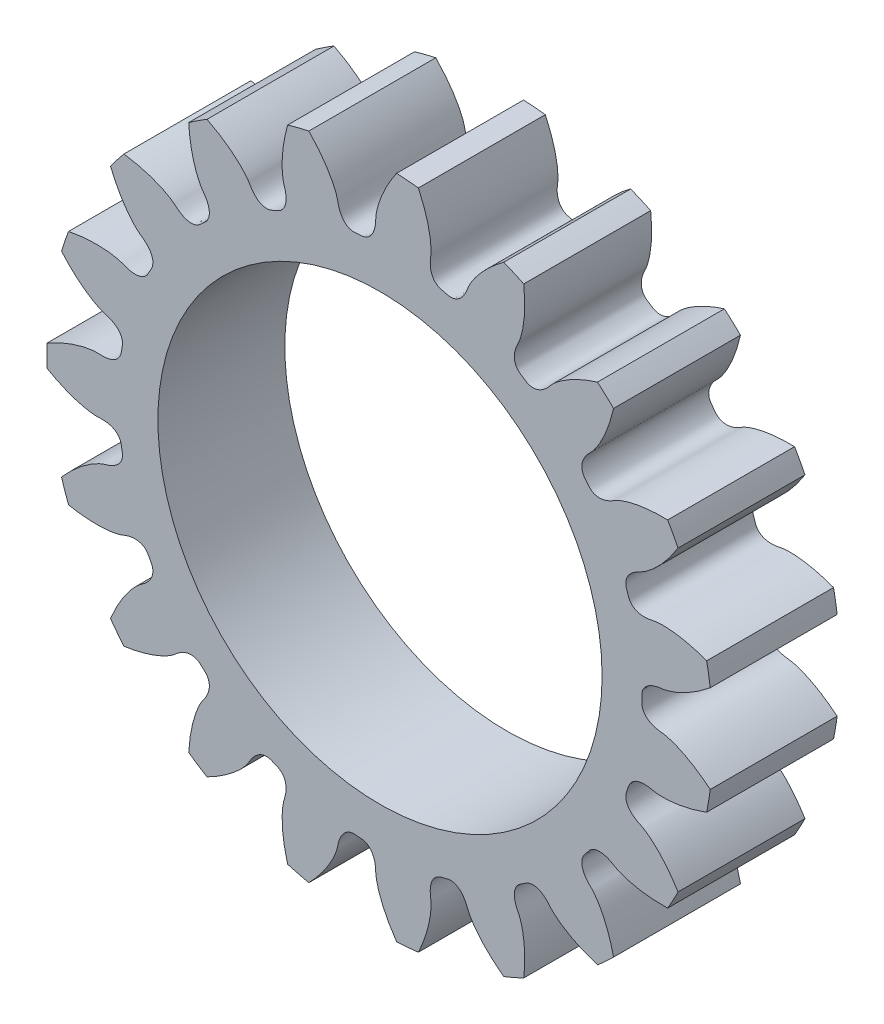
from build123d import *

# Parameters (mm, degrees)
SKETCHREVOLVESPURPINION_W       = 4
SKETCHREVOLVESPURPINION_H       = 10.499999842
TOOTHEXTRUDECUTSPURPINION_DEPTH = 2
PATTERNSPURPINION_COUNT         = 19
BOREREVOLVESKETCH_W             = 4
BOREREVOLVESKETCH_H             = 7


with BuildPart() as part:
    # SketchRevolveSpurPinion → SpurPinion (revolve)
    with BuildSketch(Plane(origin=(0, 0, 0), x_dir=(0, 0, -1), z_dir=(1, 0, 0)), mode=Mode.PRIVATE) as spurpinion_sk:
        with Locations((0, 5.249999921)):
            Rectangle(SKETCHREVOLVESPURPINION_W, SKETCHREVOLVESPURPINION_H)
    revolve(spurpinion_sk.sketch.rotate(Axis((0, 0, 0), (0, 0, -1)), 90), axis=Axis((0, 0, 0), (0, 0, -1)))

    # SketchToothSpurPinion → ToothExtrudeCutSpurPinion (cut, symmetric)
    with BuildSketch(Plane.XY):
        with BuildLine():
            ThreePointArc((10.453262131, 1.425414845), (10.549999842, 0), (10.453262131, -1.425414845))
            add(Edge.make_bspline(
                [(10.453262131, -1.425414845), (10.367326035, -1.353394637), (10.238669333, -1.251930275), (10.06564964, -1.128594361), (9.944090061, -1.047585267), (9.827560604, -0.975115164), (9.716470975, -0.910782508), (9.611210442, -0.85416847), (9.512147156, -0.804838071), (9.419627534, -0.762341023), (9.333975658, -0.726212752), (9.255492748, -0.69597514), (9.18445657, -0.671138213), (9.121121218, -0.651198945), (9.065715879, -0.635649067), (9.018446854, -0.623955761), (8.979490203, -0.615621666), (8.949010683, -0.610024033), (8.878787982, -0.599777793), (8.800543269, -0.593138323), (8.714424347, -0.574156579), (8.664508232, -0.560968978), (8.616505827, -0.545516093), (8.57026023, -0.527710712), (8.525615161, -0.507231311), (8.482414686, -0.483648426), (8.440551516, -0.456336336), (8.400050156, -0.42444098), (8.361222153, -0.386864097), (8.32489058, -0.342351194), (8.292714702, -0.289772335), (8.267151791, -0.228753234), (8.253099937, -0.165661214), (8.247308524, -0.088583022), (8.251745547, 0), (8.247308524, 0.088583022), (8.253099937, 0.165661214), (8.267151791, 0.228753234), (8.292714702, 0.289772335), (8.32489058, 0.342351194), (8.361222153, 0.386864097), (8.400050156, 0.42444098), (8.440551516, 0.456336336), (8.482414686, 0.483648426), (8.525615161, 0.507231311), (8.57026023, 0.527710712), (8.616505827, 0.545516093), (8.664508232, 0.560968978), (8.714424347, 0.574156579), (8.800543269, 0.593138323), (8.878787982, 0.599777793), (8.949010683, 0.610024033), (8.979490203, 0.615621666), (9.018446854, 0.623955761), (9.065715879, 0.635649067), (9.121121218, 0.651198945), (9.18445657, 0.671138213), (9.255492748, 0.69597514), (9.333975658, 0.726212752), (9.419627534, 0.762341023), (9.512147156, 0.804838071), (9.611210442, 0.85416847), (9.716470975, 0.910782508), (9.827560604, 0.975115164), (9.944090061, 1.047585267), (10.06564964, 1.128594361), (10.238669333, 1.251930275), (10.367326035, 1.353394637), (10.453262131, 1.425414845)],
                knots=[0, 0, 0, 0, 0.060396063, 0.088210039, 0.114434645, 0.139069881, 0.162115748, 0.183572244, 0.20343937, 0.221717126, 0.238405512, 0.253504528, 0.267014174, 0.278934451, 0.289265357, 0.298006893, 0.305159059, 0.310721856, 0.314695284, 0.343384638, 0.352907201, 0.362159078, 0.371188538, 0.380055981, 0.388837197, 0.397627176, 0.406543928, 0.415730909, 0.425354803, 0.435592533, 0.44659872, 0.458447759, 0.471062798, 0.481230687, 0.5, 0.518769313, 0.528937202, 0.541552241, 0.55340128, 0.564407467, 0.574645197, 0.584269091, 0.593456072, 0.602372824, 0.611162803, 0.619944019, 0.628811462, 0.637840922, 0.647092799, 0.656615362, 0.685304716, 0.689278144, 0.694840941, 0.701993107, 0.710734643, 0.721065549, 0.732985826, 0.746495472, 0.761594488, 0.778282874, 0.79656063, 0.816427756, 0.837884252, 0.860930119, 0.885565355, 0.911789961, 0.939603937, 1, 1, 1, 1], degree=3))
        make_face()
    toothextrudecutspurpinion = extrude(amount=TOOTHEXTRUDECUTSPURPINION_DEPTH, both=True, mode=Mode.SUBTRACT)

    # PatternSpurPinion: ToothExtrudeCutSpurPinion ×19 about axis
    patternspurpinion_axis = Axis((0, 0, 55), (0, 0, -1))
    for i in range(1, PATTERNSPURPINION_COUNT):
        add(toothextrudecutspurpinion.rotate(patternspurpinion_axis, i * 360 / PATTERNSPURPINION_COUNT), mode=Mode.SUBTRACT)

    # BoreRevolveSketch → BoreRevolveCut (revolve, cut)
    with BuildSketch(Plane(origin=(0, 0, 0), x_dir=(0, 0, -1), z_dir=(1, 0, 0)), mode=Mode.PRIVATE) as borerevolvecut_sk:
        with Locations((0, 3.5)):
            Rectangle(BOREREVOLVESKETCH_W, BOREREVOLVESKETCH_H)
    revolve(borerevolvecut_sk.sketch.rotate(Axis((0, 0, 0), (0, 0, -1)), 90), axis=Axis((0, 0, 0), (0, 0, -1)), mode=Mode.SUBTRACT)


solid = part.part
